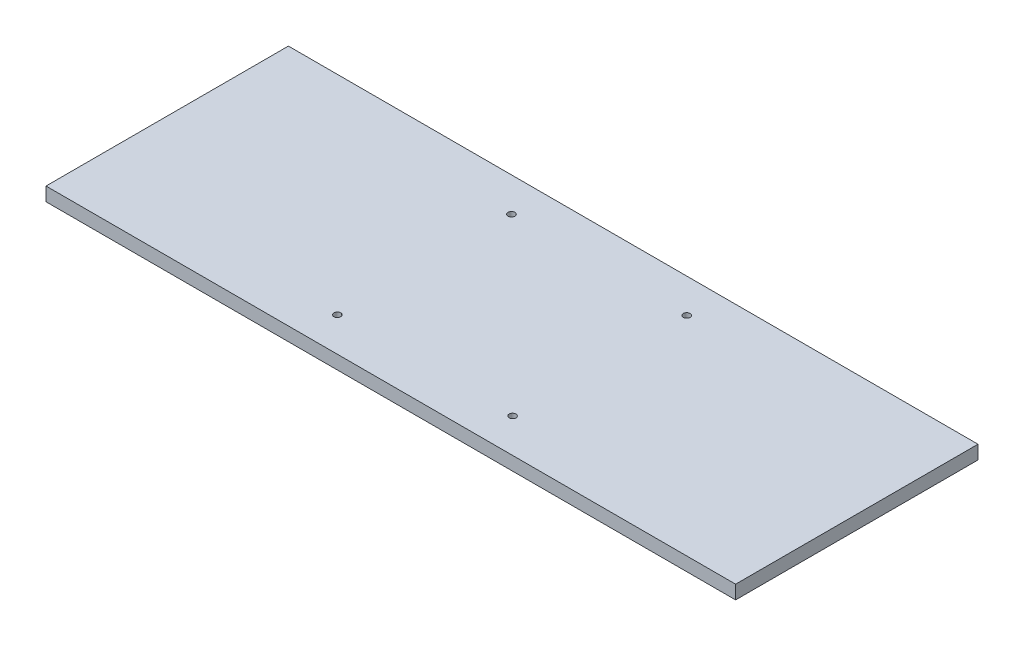
from build123d import *

# Parameters (mm, degrees)
SKETCH1_W           = 404
SKETCH1_H           = 142
SKETCH1_R           = 2
BOSS_EXTRUDE1_DEPTH = 8


with BuildPart() as part:
    # Sketch1 → Boss-Extrude1 (new body)
    with BuildSketch(Plane(origin=(0, 0, 0), x_dir=(1, 0, 0), z_dir=(0, 1, 0))):
        with Locations((202, 71)):
            Rectangle(SKETCH1_W, SKETCH1_H)
        with Locations(Location((150.666666667, 20, 0), (0, 0, 270))):
            Circle(SKETCH1_R, mode=Mode.SUBTRACT)
        with Locations(Location((253.333333333, 20, 0), (0, 0, 270))):
            Circle(SKETCH1_R, mode=Mode.SUBTRACT)
        with Locations(Location((253.333333333, 122, 0), (0, 0, 270))):
            Circle(SKETCH1_R, mode=Mode.SUBTRACT)
        with Locations(Location((150.666666667, 122, 0), (0, 0, 270))):
            Circle(SKETCH1_R, mode=Mode.SUBTRACT)
    extrude(amount=BOSS_EXTRUDE1_DEPTH)


solid = part.part
